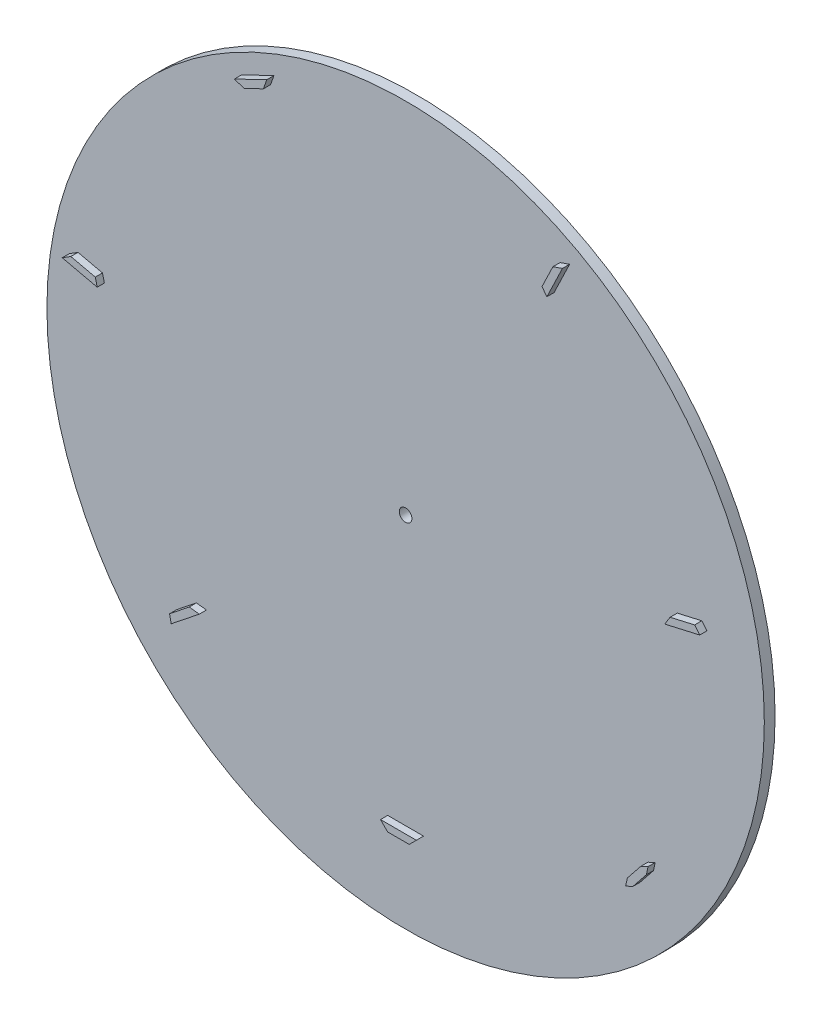
from build123d import *

# Parameters (mm, degrees)
SKETCH1_R           = 100
SKETCH1_R_2         = 1.75
BOSS_EXTRUDE1_DEPTH = 3
BOSS_EXTRUDE2_DEPTH = 2


with BuildPart() as part:
    # Sketch1 → Boss-Extrude1 (new body)
    with BuildSketch(Plane.XY):
        Circle(SKETCH1_R)
        Circle(SKETCH1_R_2, mode=Mode.SUBTRACT)
    extrude(amount=BOSS_EXTRUDE1_DEPTH)

    # Sketch2 → Boss-Extrude2 (add)
    with BuildSketch(Plane.XY.offset(3)):
        Polygon((-3, -77), (-5, -75), (5, -75), (3, -77), align=None)
        Polygon((-58.330554744, -50.354209191), (-63.803375122, -54.718637804), (-63.338227, -56.90579057), (-55.519912176, -50.670892552), align=None)
        Polygon((-91.335858635, 17.769663121), (-84.51136325, 16.212016584), (-83.981477205, 14.039639825), (-93.730756327, 16.264849165), align=None)
        Polygon((-43.054094342, 82.488453498), (-45.723799556, 83.422623755), (-36.714110877, 87.761461146), (-37.648281134, 85.091755932), align=None)
        Polygon((43.054094342, 82.488453498), (45.723799556, 83.422623755), (41.384962165, 74.412935076), (40.016908168, 76.181671422), align=None)
        Polygon((82.561507425, 15.766974716), (83.981477205, 14.039639825), (74.232198083, 11.814430486), (75.73701204, 14.209328178), align=None)
        Polygon((69.573125019, -49.087475746), (69.107976898, -51.274628512), (65.367038087, -55.965617407), (63.338227, -56.90579057), (63.803375122, -54.718637804), (67.544313933, -50.027648909), align=None)
    extrude(amount=BOSS_EXTRUDE2_DEPTH)


solid = part.part
